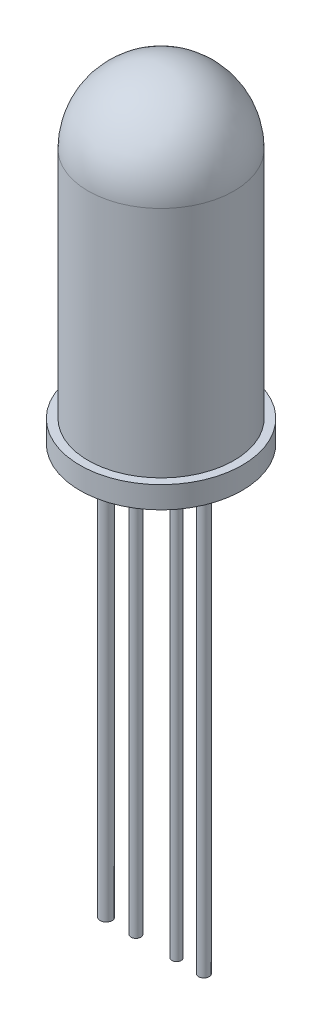
from build123d import *

# Parameters (mm, degrees)
SKETCH1_R             = 2
BOSS_EXTRUDE1_DEPTH   = 9
FILLET1_R             = 2
SKETCH2_R             = 2.225986043
SKETCH2_R_2           = 2
BOSS_EXTRUDE2_DEPTH   = 0.6
SKETCH3_R             = 0.135343866
BOSS_EXTRUDE3_DEPTH   = 12
SKETCH3_R_2           = 0.166103835
BOSS_EXTRUDE3_2_DEPTH = 12
SKETCH3_R_3           = 0.129191872
BOSS_EXTRUDE3_3_DEPTH = 12
SKETCH3_R_4           = 0.147647853
BOSS_EXTRUDE3_4_DEPTH = 12


with BuildPart() as part:
    # Sketch1 → Boss-Extrude1 (new body)
    with BuildSketch(Plane(origin=(0, 0, 0), x_dir=(1, 0, 0), z_dir=(0, 1, 0))):
        with Locations(Location((0, 0, 0), (0, 0, 270))):
            Circle(SKETCH1_R)
    extrude(amount=BOSS_EXTRUDE1_DEPTH)

    # Fillet1
    fillet1_edges = [part.edges().sort_by_distance(p)[0] for p in [
        (0, 9, -2),
    ]]
    fillet(fillet1_edges, radius=FILLET1_R)

    # Sketch2 → Boss-Extrude2 (add)
    with BuildSketch(Plane.XZ):
        with Locations(Location((0, 0, 0), (0, 0, 270))):
            Circle(SKETCH2_R)
        with Locations(Location((0, 0, 0), (0, 0, 270))):
            Circle(SKETCH2_R_2, mode=Mode.SUBTRACT)
    extrude(amount=-BOSS_EXTRUDE2_DEPTH)


with BuildPart() as body_2:
    # Sketch3 → Boss-Extrude3 (new body)
    with BuildSketch(Plane.XZ):
        with Locations(Location((-0.689023316, 0, 0), (0, 0, 270))):
            Circle(SKETCH3_R)
    extrude(amount=BOSS_EXTRUDE3_DEPTH)


with BuildPart() as body_3:
    # Sketch3 → Boss-Extrude3 2 (new body)
    with BuildSketch(Plane.XZ):
        with Locations(Location((-1.507238504, 0, 0), (0, 0, 270))):
            Circle(SKETCH3_R_2)
    extrude(amount=BOSS_EXTRUDE3_2_DEPTH)


with BuildPart() as body_4:
    # Sketch3 → Boss-Extrude3 3 (new body)
    with BuildSketch(Plane.XZ):
        with Locations(Location((0.424487579, 0, 0), (0, 0, 270))):
            Circle(SKETCH3_R_3)
    extrude(amount=BOSS_EXTRUDE3_3_DEPTH)


with BuildPart() as body_5:
    # Sketch3 → Boss-Extrude3 4 (new body)
    with BuildSketch(Plane.XZ):
        with Locations(Location((1.175030834, 0, 0), (0, 0, 270))):
            Circle(SKETCH3_R_4)
    extrude(amount=BOSS_EXTRUDE3_4_DEPTH)


solid = Compound([part.part, body_2.part, body_3.part, body_4.part, body_5.part])
